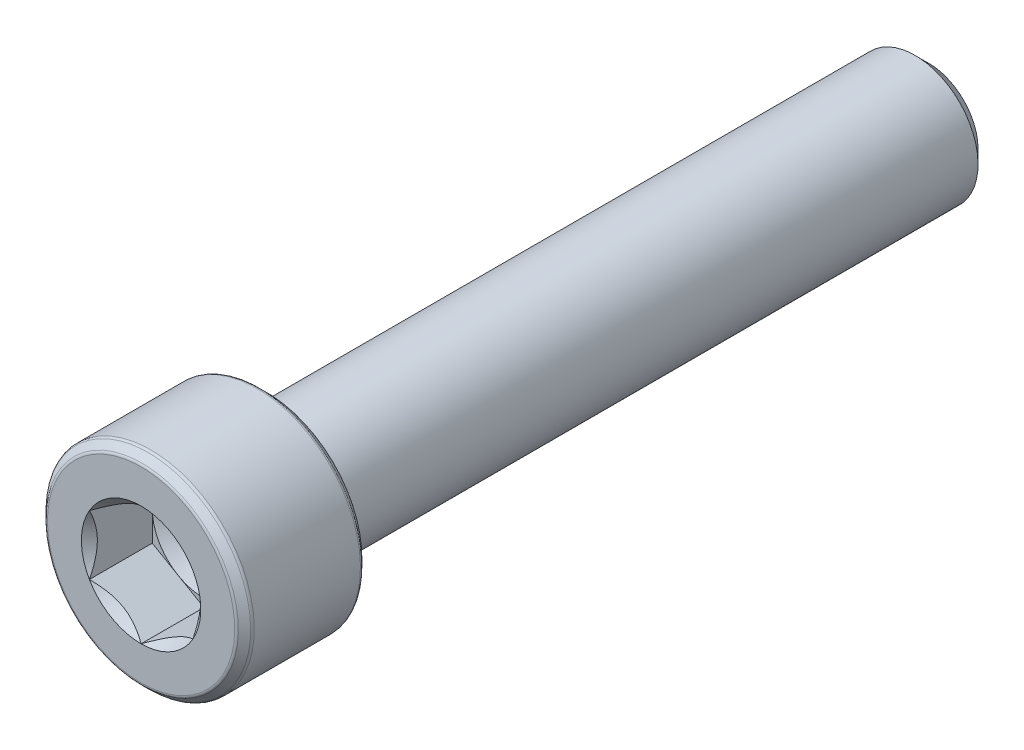
from build123d import *

# Parameters (mm, degrees)
CUT_EXTRUDE1_DEPTH = 2.413


with BuildPart() as part:
    # Sketch3 → Revolve1 (revolve)
    with BuildSketch(Plane(origin=(0, 0, 0), x_dir=(0, 0, -1), z_dir=(1, 0, 0)), mode=Mode.PRIVATE) as revolve1_sk:
        with BuildLine():
            Line((-15.113, 3.593713147), (-15.113, 1.984375))
            Line((-15.113, 1.984375), (-12.7, 1.984375))
            Line((-12.7, 1.984375), (-12.7, 0))
            Line((-12.7, 0), (15.113, 0))
            Line((15.113, 0), (15.113, 1.897444252))
            Line((15.113, 1.897444252), (14.597444252, 2.413))
            Line((14.597444252, 2.413), (-10.287, 2.413))
            Line((-10.287, 2.413), (-10.287, 3.593713147))
            ThreePointArc((-10.287, 3.593713147), (-10.297573609, 3.646870268), (-10.327684699, 3.691934699))
            Line((-10.327684699, 3.691934699), (-10.563815301, 3.928065301))
            ThreePointArc((-10.563815301, 3.928065301), (-10.608879732, 3.958176391), (-10.662036853, 3.96875))
            Line((-10.662036853, 3.96875), (-14.737963147, 3.96875))
            ThreePointArc((-14.737963147, 3.96875), (-14.791120268, 3.958176391), (-14.836184699, 3.928065301))
            Line((-14.836184699, 3.928065301), (-15.072315301, 3.691934699))
            ThreePointArc((-15.072315301, 3.691934699), (-15.102426391, 3.646870268), (-15.113, 3.593713147))
        make_face()
    revolve(revolve1_sk.sketch.rotate(Axis((0, 0, 15.113), (0, 0, -1)), 180), axis=Axis((0, 0, 15.113), (0, 0, -1)))

    # Sketch4 → Cut-Extrude1 (cut)
    with BuildSketch(Plane.XY.offset(15.113)):
        Polygon((0, 2.291358881), (-1.984375, 1.14567944), (-1.984375, -1.14567944), (0, -2.291358881), (1.984375, -1.14567944), (1.984375, 1.14567944), align=None)
    extrude(amount=-CUT_EXTRUDE1_DEPTH, mode=Mode.SUBTRACT)

    # Cut-Extrude2 cone 1 section (through the dimple's axis) → Cut-Extrude2 (revolve, cut)
    with BuildSketch(Plane(origin=(0, 0, 15.113), x_dir=(0, -1, 0), z_dir=(1, 0, 0))):
        Polygon((0, 0), (2.291358881, 0), (0, 2.291358881), align=None)
    revolve(axis=Axis((0, 0, 15.113), (0, 0, -1)), mode=Mode.SUBTRACT)

    # Cut-Extrude3 cone 1 section (through the dimple's axis) → Cut-Extrude3 (revolve, cut)
    with BuildSketch(Plane(origin=(0, 0, 12.7), x_dir=(0, -1, 0), z_dir=(1, 0, 0))):
        Polygon((0, 0), (1.984375, 0), (0, 1.14567944), align=None)
    revolve(axis=Axis((0, 0, 12.7), (0, 0, -1)), mode=Mode.SUBTRACT)


solid = part.part
